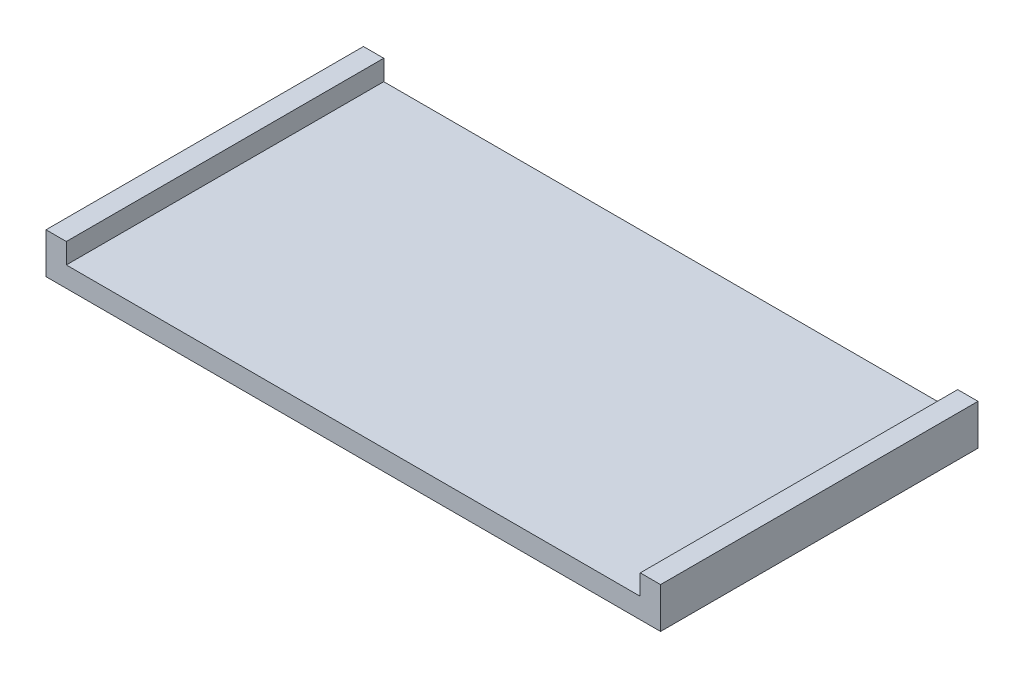
from build123d import *

# Parameters (mm, degrees)
BOSS_EXTRUDE1_DEPTH = 1.6
SKETCH2_W           = 1.6
SKETCH2_H           = 25
BOSS_EXTRUDE2_DEPTH = 1.6


with BuildPart() as part:
    # Sketch1 → Boss-Extrude1 (new body)
    with BuildSketch(Plane(origin=(0, 0, 0), x_dir=(1, 0, 0), z_dir=(0, 1, 0))):
        Polygon((0, 0), (24.2, 0), (24.2, 25), (-24.2, 25), (-24.2, 0), align=None)
    extrude(amount=BOSS_EXTRUDE1_DEPTH)

    # Sketch2 → Boss-Extrude2 (add)
    with BuildSketch(Plane(origin=(0, 1.6, 0), x_dir=(1, 0, 0), z_dir=(0, 1, 0))):
        with Locations((-23.4, 12.5)):
            Rectangle(SKETCH2_W, SKETCH2_H)
        with Locations((23.4, 12.5)):
            Rectangle(SKETCH2_W, SKETCH2_H)
    extrude(amount=BOSS_EXTRUDE2_DEPTH)


solid = part.part
